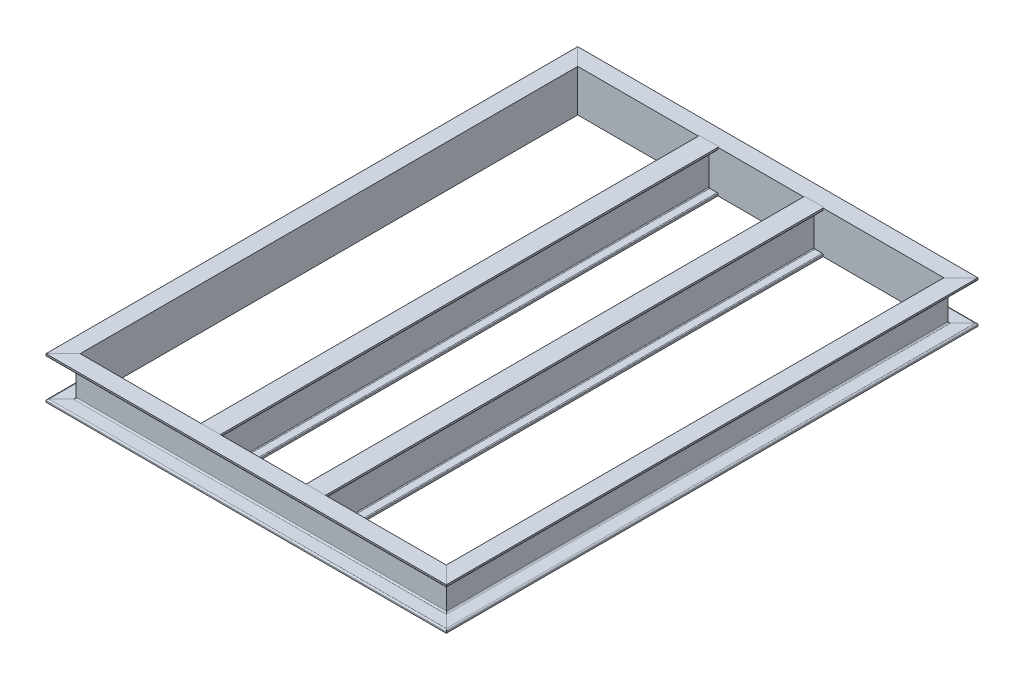
from build123d import *

# Parameters (mm, degrees)
MIEMBRO_ESTRUCTURAL2_DEPTH      = 2001.754962657
MIEMBRO_ESTRUCTURAL2_DEPTH_BACK = 101.754962657
MIEMBRO_ESTRUCTURAL2_2_DEPTH    = 1603.509925314
MIEMBRO_ESTRUCTURAL2_3_DEPTH    = 2103.509925314
MIEMBRO_ESTRUCTURAL2_4_DEPTH    = 1603.509925314
MIEMBRO_ESTRUCTURAL4_DEPTH      = 1900
MIEMBRO_ESTRUCTURAL4_2_DEPTH    = 1900


with BuildPart() as part:
    # Croquis12 → Miembro estructural2 (new, two sides: drawn at the far end of the back side and taken through both)
    with BuildSketch(Plane(origin=(-700, 0, 950), x_dir=(-1, 0, 0), z_dir=(0, 0, -1)).offset(-MIEMBRO_ESTRUCTURAL2_DEPTH_BACK)):
        with BuildLine():
            Line((-3.75, -80), (-3.75, 80))
            Line((-3.75, 80), (61.25, 80))
            Line((61.25, 80), (61.25, 75))
            ThreePointArc((61.25, 75), (59.639087297, 71.110912703), (55.75, 69.5))
            Line((55.75, 69.5), (9.25, 69.5))
            ThreePointArc((9.25, 69.5), (5.360912703, 67.889087297), (3.75, 64))
            Line((3.75, 64), (3.75, -64))
            ThreePointArc((3.75, -64), (5.360912703, -67.889087297), (9.25, -69.5))
            Line((9.25, -69.5), (55.75, -69.5))
            ThreePointArc((55.75, -69.5), (59.639087297, -71.110912703), (61.25, -75))
            Line((61.25, -75), (61.25, -80))
            Line((61.25, -80), (-3.75, -80))
        make_face()
    extrude(amount=MIEMBRO_ESTRUCTURAL2_DEPTH + MIEMBRO_ESTRUCTURAL2_DEPTH_BACK)

    # Miembro estructural2 mitre 1
    split(bisect_by=Plane(origin=(-700, 0, 950), x_dir=(0, -1, 0), z_dir=(-0.707106781, 0, -0.707106781)), keep=Keep.TOP)

    # Miembro estructural2 mitre 2
    split(bisect_by=Plane(origin=(-700, 0, -950), x_dir=(0, -1, 0), z_dir=(-0.707106781, 0, 0.707106781)), keep=Keep.TOP)


with BuildPart() as body_2:
    # Croquis12 on segment 2 (carried to segment 2) → Miembro estructural2 2 (new body)
    with BuildSketch(Plane(origin=(-801.754962657, 0, -950), x_dir=(0, 0, -1), z_dir=(1, 0, 0))):
        with BuildLine():
            Line((-3.75, -80), (-3.75, 80))
            Line((-3.75, 80), (61.25, 80))
            Line((61.25, 80), (61.25, 75))
            ThreePointArc((61.25, 75), (59.639087297, 71.110912703), (55.75, 69.5))
            Line((55.75, 69.5), (9.25, 69.5))
            ThreePointArc((9.25, 69.5), (5.360912703, 67.889087297), (3.75, 64))
            Line((3.75, 64), (3.75, -64))
            ThreePointArc((3.75, -64), (5.360912703, -67.889087297), (9.25, -69.5))
            Line((9.25, -69.5), (55.75, -69.5))
            ThreePointArc((55.75, -69.5), (59.639087297, -71.110912703), (61.25, -75))
            Line((61.25, -75), (61.25, -80))
            Line((61.25, -80), (-3.75, -80))
        make_face()
    extrude(amount=MIEMBRO_ESTRUCTURAL2_2_DEPTH)

    # Miembro estructural2 2 mitre 1
    split(bisect_by=Plane(origin=(-700, 0, -950), x_dir=(0, 1, 0), z_dir=(0.707106781, 0, -0.707106781)), keep=Keep.TOP)

    # Miembro estructural2 2 mitre 2
    split(bisect_by=Plane(origin=(700, 0, -950), x_dir=(0, -1, 0), z_dir=(-0.707106781, 0, -0.707106781)), keep=Keep.TOP)


with BuildPart() as body_3:
    # Croquis12 on segment 3 (carried to segment 3) → Miembro estructural2 3 (new body)
    with BuildSketch(Plane(origin=(700, 0, -1051.754962657), x_dir=(1, 0, 0), z_dir=(0, 0, 1))):
        with BuildLine():
            Line((-3.75, -80), (-3.75, 80))
            Line((-3.75, 80), (61.25, 80))
            Line((61.25, 80), (61.25, 75))
            ThreePointArc((61.25, 75), (59.639087297, 71.110912703), (55.75, 69.5))
            Line((55.75, 69.5), (9.25, 69.5))
            ThreePointArc((9.25, 69.5), (5.360912703, 67.889087297), (3.75, 64))
            Line((3.75, 64), (3.75, -64))
            ThreePointArc((3.75, -64), (5.360912703, -67.889087297), (9.25, -69.5))
            Line((9.25, -69.5), (55.75, -69.5))
            ThreePointArc((55.75, -69.5), (59.639087297, -71.110912703), (61.25, -75))
            Line((61.25, -75), (61.25, -80))
            Line((61.25, -80), (-3.75, -80))
        make_face()
    extrude(amount=MIEMBRO_ESTRUCTURAL2_3_DEPTH)

    # Miembro estructural2 3 mitre 1
    split(bisect_by=Plane(origin=(700, 0, 950), x_dir=(0, 1, 0), z_dir=(0.707106781, 0, -0.707106781)), keep=Keep.TOP)

    # Miembro estructural2 3 mitre 2
    split(bisect_by=Plane(origin=(700, 0, -950), x_dir=(0, 1, 0), z_dir=(0.707106781, 0, 0.707106781)), keep=Keep.TOP)


with BuildPart() as body_4:
    # Croquis12 on segment 4 (carried to segment 4) → Miembro estructural2 4 (new body)
    with BuildSketch(Plane(origin=(801.754962657, 0, 950), x_dir=(0, 0, 1), z_dir=(-1, 0, 0))):
        with BuildLine():
            Line((-3.75, -80), (-3.75, 80))
            Line((-3.75, 80), (61.25, 80))
            Line((61.25, 80), (61.25, 75))
            ThreePointArc((61.25, 75), (59.639087297, 71.110912703), (55.75, 69.5))
            Line((55.75, 69.5), (9.25, 69.5))
            ThreePointArc((9.25, 69.5), (5.360912703, 67.889087297), (3.75, 64))
            Line((3.75, 64), (3.75, -64))
            ThreePointArc((3.75, -64), (5.360912703, -67.889087297), (9.25, -69.5))
            Line((9.25, -69.5), (55.75, -69.5))
            ThreePointArc((55.75, -69.5), (59.639087297, -71.110912703), (61.25, -75))
            Line((61.25, -75), (61.25, -80))
            Line((61.25, -80), (-3.75, -80))
        make_face()
    extrude(amount=MIEMBRO_ESTRUCTURAL2_4_DEPTH)

    # Miembro estructural2 4 mitre 1
    split(bisect_by=Plane(origin=(-700, 0, 950), x_dir=(0, 1, 0), z_dir=(0.707106781, 0, 0.707106781)), keep=Keep.TOP)

    # Miembro estructural2 4 mitre 2
    split(bisect_by=Plane(origin=(700, 0, 950), x_dir=(0, -1, 0), z_dir=(-0.707106781, 0, 0.707106781)), keep=Keep.TOP)


with BuildPart() as body_5:
    # Croquis2 → Miembro estructural4 (new body)
    with BuildSketch(Plane(origin=(-200, 0, -950), x_dir=(1, 0, 0), z_dir=(0, 0, 1))):
        with BuildLine():
            Line((37, 80), (-37, 80))
            Line((-37, 80), (-37, 73.68))
            ThreePointArc((-37, 73.68), (-36.068599564, 71.431400436), (-33.82, 70.5))
            Line((-33.82, 70.5), (-6.35, 70.5))
            ThreePointArc((-6.35, 70.5), (-4.101400436, 69.568599564), (-3.17, 67.32))
            Line((-3.17, 67.32), (-3.17, -67.32))
            ThreePointArc((-3.17, -67.32), (-4.101400436, -69.568599564), (-6.35, -70.5))
            Line((-6.35, -70.5), (-33.82, -70.5))
            ThreePointArc((-33.82, -70.5), (-36.068599564, -71.431400436), (-37, -73.68))
            Line((-37, -73.68), (-37, -80))
            Line((-37, -80), (37, -80))
            Line((37, -80), (37, -73.68))
            ThreePointArc((37, -73.68), (36.068599564, -71.431400436), (33.82, -70.5))
            Line((33.82, -70.5), (6.35, -70.5))
            ThreePointArc((6.35, -70.5), (4.101400436, -69.568599564), (3.17, -67.32))
            Line((3.17, -67.32), (3.17, 67.32))
            ThreePointArc((3.17, 67.32), (4.101400436, 69.568599564), (6.35, 70.5))
            Line((6.35, 70.5), (33.82, 70.5))
            ThreePointArc((33.82, 70.5), (36.068599564, 71.431400436), (37, 73.68))
            Line((37, 73.68), (37, 80))
        make_face()
    extrude(amount=MIEMBRO_ESTRUCTURAL4_DEPTH)


with BuildPart() as body_6:
    # Croquis2 on segment 2 (carried to segment 2) → Miembro estructural4 2 (new body)
    with BuildSketch(Plane(origin=(200, 0, -950), x_dir=(1, 0, 0), z_dir=(0, 0, 1))):
        with BuildLine():
            Line((37, 80), (-37, 80))
            Line((-37, 80), (-37, 73.68))
            ThreePointArc((-37, 73.68), (-36.068599564, 71.431400436), (-33.82, 70.5))
            Line((-33.82, 70.5), (-6.35, 70.5))
            ThreePointArc((-6.35, 70.5), (-4.101400436, 69.568599564), (-3.17, 67.32))
            Line((-3.17, 67.32), (-3.17, -67.32))
            ThreePointArc((-3.17, -67.32), (-4.101400436, -69.568599564), (-6.35, -70.5))
            Line((-6.35, -70.5), (-33.82, -70.5))
            ThreePointArc((-33.82, -70.5), (-36.068599564, -71.431400436), (-37, -73.68))
            Line((-37, -73.68), (-37, -80))
            Line((-37, -80), (37, -80))
            Line((37, -80), (37, -73.68))
            ThreePointArc((37, -73.68), (36.068599564, -71.431400436), (33.82, -70.5))
            Line((33.82, -70.5), (6.35, -70.5))
            ThreePointArc((6.35, -70.5), (4.101400436, -69.568599564), (3.17, -67.32))
            Line((3.17, -67.32), (3.17, 67.32))
            ThreePointArc((3.17, 67.32), (4.101400436, 69.568599564), (6.35, 70.5))
            Line((6.35, 70.5), (33.82, 70.5))
            ThreePointArc((33.82, 70.5), (36.068599564, 71.431400436), (37, 73.68))
            Line((37, 73.68), (37, 80))
        make_face()
    extrude(amount=MIEMBRO_ESTRUCTURAL4_2_DEPTH)


solid = Compound([part.part, body_2.part, body_3.part, body_4.part, body_5.part, body_6.part])
